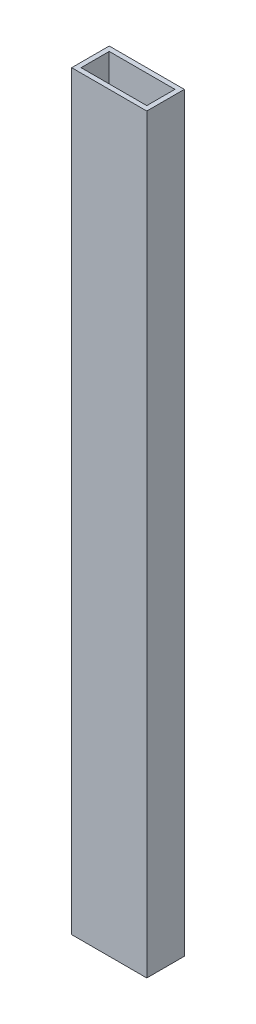
from build123d import *

# Parameters (mm, degrees)
SKETCH1_W           = 50.8
SKETCH1_H           = 25.4
SKETCH1_W_2         = 44.45
SKETCH1_H_2         = 19.05
BOSS_EXTRUDE1_DEPTH = 254


with BuildPart() as part:
    # Sketch1 → Boss-Extrude1 (new, symmetric)
    with BuildSketch(Plane(origin=(0, 0, 0), x_dir=(1, 0, 0), z_dir=(0, 1, 0))):
        Rectangle(SKETCH1_W, SKETCH1_H)
        Rectangle(SKETCH1_W_2, SKETCH1_H_2, mode=Mode.SUBTRACT)
    extrude(amount=BOSS_EXTRUDE1_DEPTH, both=True)


solid = part.part
